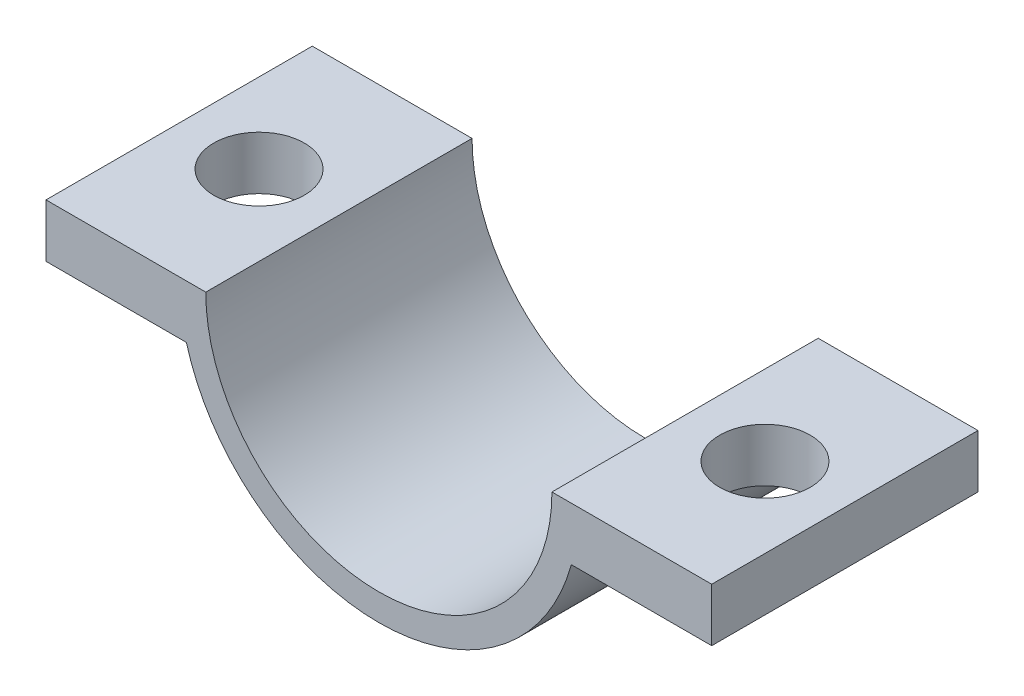
from build123d import *

# Parameters (mm, degrees)
EXTRUDE_1_DEPTH     = 10
SKETCH_2_R          = 1.7
CUT_EXTRUDE_1_DEPTH = 10


with BuildPart() as part:
    # 草图1 → 凸台-拉伸1 (new body)
    with BuildSketch(Plane.XY):
        with BuildLine():
            Line((-6.5, 0), (-12.5, 0))
            Line((-12.5, 0), (-12.5, -2))
            Line((-12.5, -2), (-7.228416147, -2))
            ThreePointArc((-7.228416147, -2), (-4.554295868, -5.958891604), (-0.032245386, -7.499930682))
            ThreePointArc((-0.032245386, -7.499930682), (4.528634207, -5.9784172), (7.228416147, -2))
            Line((7.228416147, -2), (12.5, -2))
            Line((12.5, -2), (12.5, 0))
            Line((12.5, 0), (6.5, 0))
            ThreePointArc((6.5, 0), (0, -6.5), (-6.5, 0))
        make_face()
    extrude(amount=EXTRUDE_1_DEPTH)

    # 草图2 → 切除-拉伸1 (cut)
    with BuildSketch(Plane(origin=(0, 0, 0), x_dir=(1, 0, 0), z_dir=(0, 1, 0))):
        with Locations(Location((-9.5, -5, 0), (0, 0, 270))):
            Circle(SKETCH_2_R)
        with Locations(Location((9.5, -5, 0), (0, 0, 270))):
            Circle(SKETCH_2_R)
    extrude(amount=-CUT_EXTRUDE_1_DEPTH, mode=Mode.SUBTRACT)


solid = part.part
